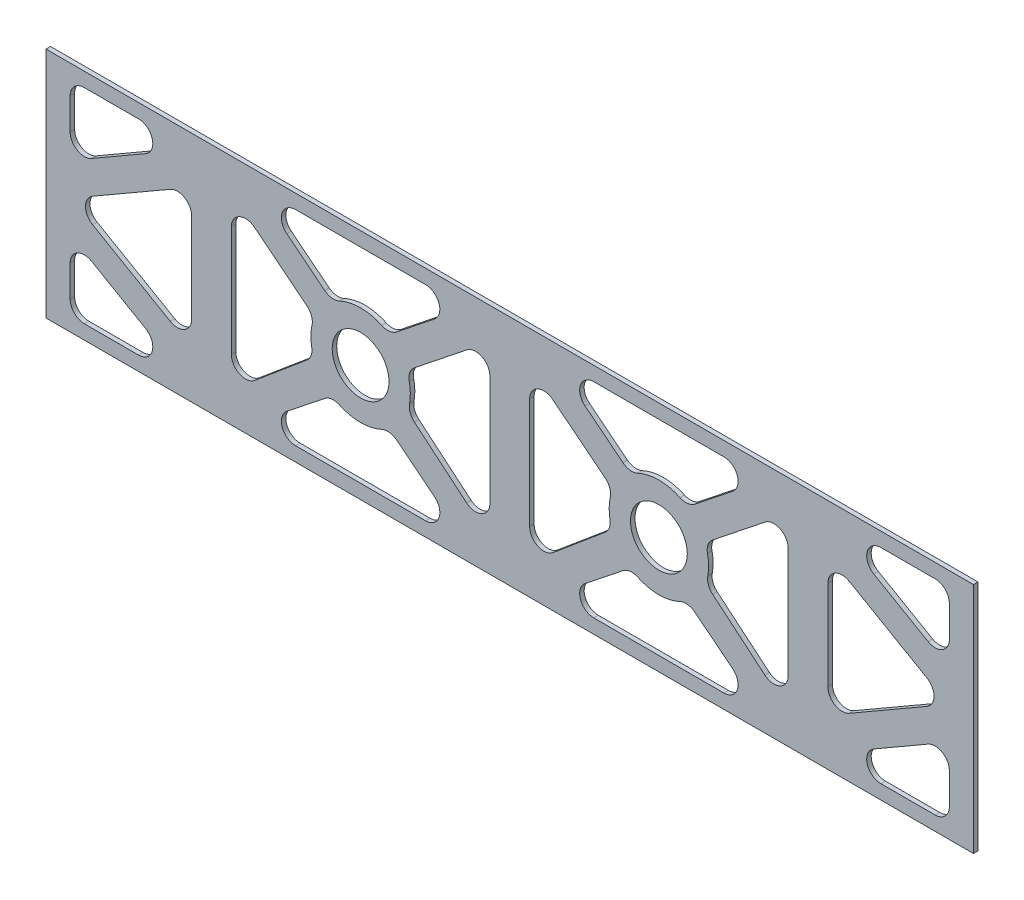
from build123d import *

# Parameters (mm, degrees)
SKETCH1_W            = 326.5
SKETCH1_H            = 82
BOSS_EXTRUDE1_DEPTH  = 1.5875
SKETCH2_R            = 10
CUT_EXTRUDE1_DEPTH   = 337.643387216
FILLET1_R            = 5
FILLET2_R            = 5
FILLET1_OF_MIRROR1_R = 5
FILLET2_OF_MIRROR1_R = 5


with BuildPart() as part:
    # Sketch1 → Boss-Extrude1 (new body)
    with BuildSketch(Plane.XY):
        with Locations((163.25, -41)):
            Rectangle(SKETCH1_W, SKETCH1_H)
    extrude(amount=BOSS_EXTRUDE1_DEPTH)

    # Sketch2 → Cut-Extrude1 (cut, through all)
    with BuildSketch(Plane.XY.offset(1.5875)):
        with BuildLine():
            Line((261.25, -60.453756551), (261.25, -21.546243449))
            ThreePointArc((261.25, -21.546243449), (258.421566961, -17.042434291), (253.136281226, -17.634114183))
            Line((253.136281226, -17.634114183), (231.985399239, -34.468399005))
            ThreePointArc((231.985399239, -34.468399005), (233.246092528, -40.630207826), (232.246877073, -46.839781402))
            Line((232.246877073, -46.839781402), (253.036061952, -64.283978766))
            ThreePointArc((253.036061952, -64.283978766), (258.363091309, -64.985295486), (261.25, -60.453756551))
        make_face()
        with BuildLine():
            ThreePointArc((205.742038309, -26.644140472), (215.75, -23.5), (225.757961691, -26.644140472))
            Line((225.757961691, -26.644140472), (241.754677282, -13.912129266))
            ThreePointArc((241.754677282, -13.912129266), (243.361162229, -8.350855727), (238.640958508, -5))
            Line((238.640958508, -5), (192.859041492, -5))
            ThreePointArc((192.859041492, -5), (188.138837771, -8.350855727), (189.745322718, -13.912129266))
            Line((189.745322718, -13.912129266), (205.742038309, -26.644140472))
        make_face()
        with BuildLine():
            Line((241.754677282, -68.087870734), (225.757961691, -55.355859528))
            ThreePointArc((225.757961691, -55.355859528), (215.75, -58.5), (205.742038309, -55.355859528))
            Line((205.742038309, -55.355859528), (189.745322718, -68.087870734))
            ThreePointArc((189.745322718, -68.087870734), (188.138837771, -73.649144273), (192.859041492, -77))
            Line((192.859041492, -77), (238.640958508, -77))
            ThreePointArc((238.640958508, -77), (243.361162229, -73.649144273), (241.754677282, -68.087870734))
        make_face()
        with BuildLine():
            ThreePointArc((199.253122927, -46.839781402), (198.253907472, -40.630207826), (199.514600761, -34.468399005))
            Line((199.514600761, -34.468399005), (178.363718774, -17.634114183))
            ThreePointArc((178.363718774, -17.634114183), (173.078433039, -17.042434291), (170.25, -21.546243449))
            Line((170.25, -21.546243449), (170.25, -60.453756551))
            ThreePointArc((170.25, -60.453756551), (173.136908691, -64.985295486), (178.463938048, -64.283978766))
            Line((178.463938048, -64.283978766), (199.253122927, -46.839781402))
        make_face()
        with BuildLine():
            Line((313, -5), (293.910254038, -5))
            ThreePointArc((293.910254038, -5), (289.080624906, -8.705904774), (291.410254038, -14.330127019))
            Line((291.410254038, -14.330127019), (310.5, -25.351596989))
            ThreePointArc((310.5, -25.351596989), (315.5, -25.351596989), (318, -21.02146997))
            Line((318, -21.02146997), (318, -10))
            ThreePointArc((318, -10), (316.535533906, -6.464466094), (313, -5))
        make_face()
        with BuildLine():
            ThreePointArc((315.5, -42.214646281), (316.262390864, -41.673556851), (316.910726246, -41))
            ThreePointArc((316.910726246, -41), (316.262390864, -40.326443149), (315.5, -39.785353719))
            Line((315.5, -39.785353719), (282.75, -20.877132403))
            ThreePointArc((282.75, -20.877132403), (277.75, -20.877132403), (275.25, -25.207259422))
            Line((275.25, -25.207259422), (275.25, -56.792740578))
            ThreePointArc((275.25, -56.792740578), (277.75, -61.122867597), (282.75, -61.122867597))
            Line((282.75, -61.122867597), (315.5, -42.214646281))
        make_face()
        with BuildLine():
            Line((310.5, -56.648403011), (291.410254038, -67.669872981))
            ThreePointArc((291.410254038, -67.669872981), (289.080624906, -73.294095226), (293.910254038, -77))
            Line((293.910254038, -77), (313, -77))
            ThreePointArc((313, -77), (316.535533906, -75.535533906), (318, -72))
            Line((318, -72), (318, -60.97853003))
            ThreePointArc((318, -60.97853003), (315.5, -56.648403011), (310.5, -56.648403011))
        make_face()
        with Locations((215.75, -41)):
            Circle(SKETCH2_R)
    cut_extrude1 = extrude(amount=-CUT_EXTRUDE1_DEPTH, mode=Mode.SUBTRACT)

    # Fillet1
    fillet1_edges = [part.edges().sort_by_distance(p)[0] for p in [
        (232.246877073, -46.839781402, 0.79375),
        (231.985399239, -34.468399005, 0.79375),
        (205.742038309, -55.355859528, 0.79375),
        (225.757961691, -55.355859528, 0.79375),
        (199.514600761, -34.468399005, 0.79375),
        (199.253122927, -46.839781402, 0.79375),
        (225.757961691, -26.644140472, 0.79375),
        (205.742038309, -26.644140472, 0.79375),
    ]]
    fillet(fillet1_edges, radius=FILLET1_R)

    # Fillet2
    fillet2_edges = [part.edges().sort_by_distance(p)[0] for p in [
        (316.910726246, -41, 0.79375),
    ]]
    fillet(fillet2_edges, radius=FILLET2_R)

    # Mirror1: Cut-Extrude1 across plane
    add(cut_extrude1.mirror(Plane.ZY.offset(-163.25)), mode=Mode.SUBTRACT)

    # Fillet1 of Mirror1
    fillet1_of_mirror1_edges = [part.edges().sort_by_distance(p)[0] for p in [
        (94.253122927, -46.839781402, 0.79375),
        (94.514600761, -34.468399005, 0.79375),
        (120.757961691, -55.355859528, 0.79375),
        (100.742038309, -55.355859528, 0.79375),
        (126.985399239, -34.468399005, 0.79375),
        (127.246877073, -46.839781402, 0.79375),
        (100.742038309, -26.644140472, 0.79375),
        (120.757961691, -26.644140472, 0.79375),
    ]]
    fillet(fillet1_of_mirror1_edges, radius=FILLET1_OF_MIRROR1_R)

    # Fillet2 of Mirror1
    fillet2_of_mirror1_edges = [part.edges().sort_by_distance(p)[0] for p in [
        (9.589273754, -41, 0.79375),
    ]]
    fillet(fillet2_of_mirror1_edges, radius=FILLET2_OF_MIRROR1_R)


solid = part.part
